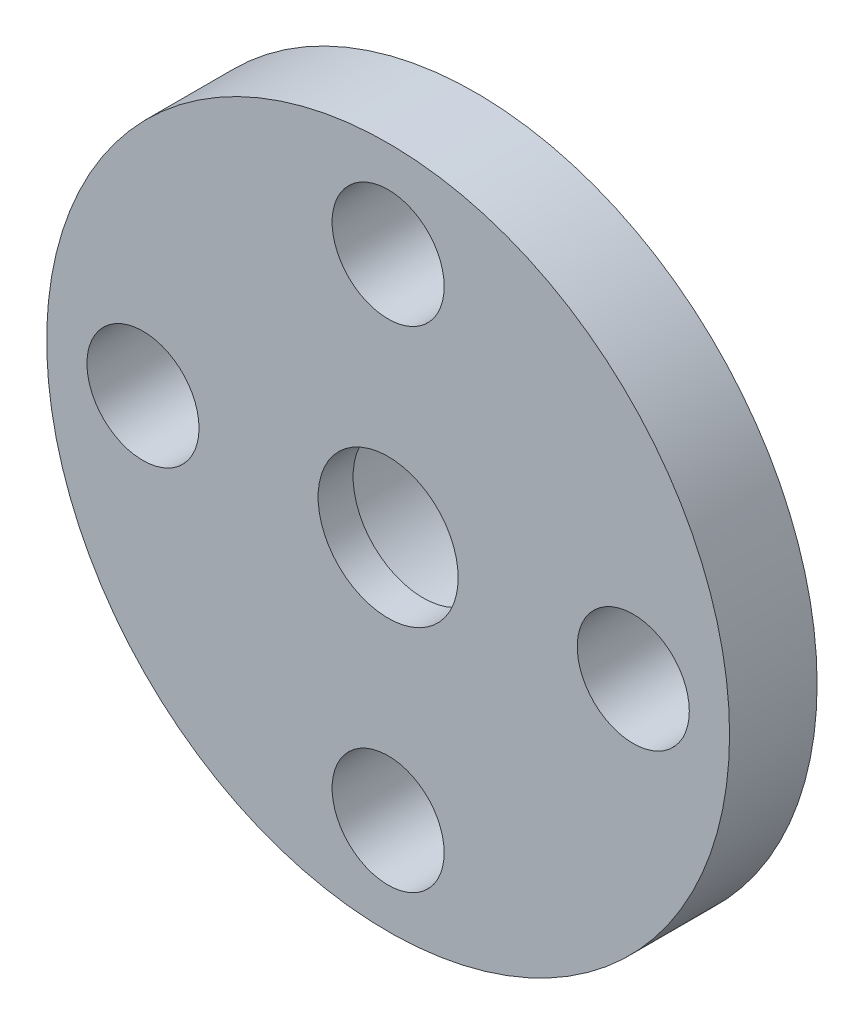
from build123d import *

# Parameters (mm, degrees)
IZIM1_R                     = 9.75
IZIM1_R_2                   = 1.6
Y_KSEKLIK_EKSTR_ZYON4_DEPTH = 2.5
IZIM13_R                    = 4
Y_KSEKLIK_EKSTR_ZYON6_DEPTH = 3
IZIM14_R                    = 3
KES_EKSTR_ZYON4_DEPTH       = 4.5
IZIM15_R                    = 2
KES_EKSTR_ZYON5_DEPTH       = 2.5


with BuildPart() as part:
    # Çizim1 → Yükseklik-Ekstrüzyon4 (new body)
    with BuildSketch(Plane.XY):
        Circle(IZIM1_R)
        with Locations((-7, 0)):
            Circle(IZIM1_R_2, mode=Mode.SUBTRACT)
        with Locations((0, 7)):
            Circle(IZIM1_R_2, mode=Mode.SUBTRACT)
        with Locations((7, 0)):
            Circle(IZIM1_R_2, mode=Mode.SUBTRACT)
        with Locations((0, -7)):
            Circle(IZIM1_R_2, mode=Mode.SUBTRACT)
    extrude(amount=Y_KSEKLIK_EKSTR_ZYON4_DEPTH)

    # Çizim13 → Yükseklik-Ekstrüzyon6 (add)
    with BuildSketch(Plane(origin=(0, 0, 0), x_dir=(-1, 0, 0), z_dir=(0, 0, -1))):
        Circle(IZIM13_R)
    extrude(amount=Y_KSEKLIK_EKSTR_ZYON6_DEPTH)

    # Çizim14 → Kes-Ekstrüzyon4 (cut)
    with BuildSketch(Plane(origin=(0, 0, -3), x_dir=(-1, 0, 0), z_dir=(0, 0, -1))):
        Circle(IZIM14_R)
    extrude(amount=-KES_EKSTR_ZYON4_DEPTH, mode=Mode.SUBTRACT)

    # Çizim15 → Kes-Ekstrüzyon5 (cut)
    with BuildSketch(Plane.XY.offset(2.5)):
        Circle(IZIM15_R)
    extrude(amount=-KES_EKSTR_ZYON5_DEPTH, mode=Mode.SUBTRACT)


solid = part.part
